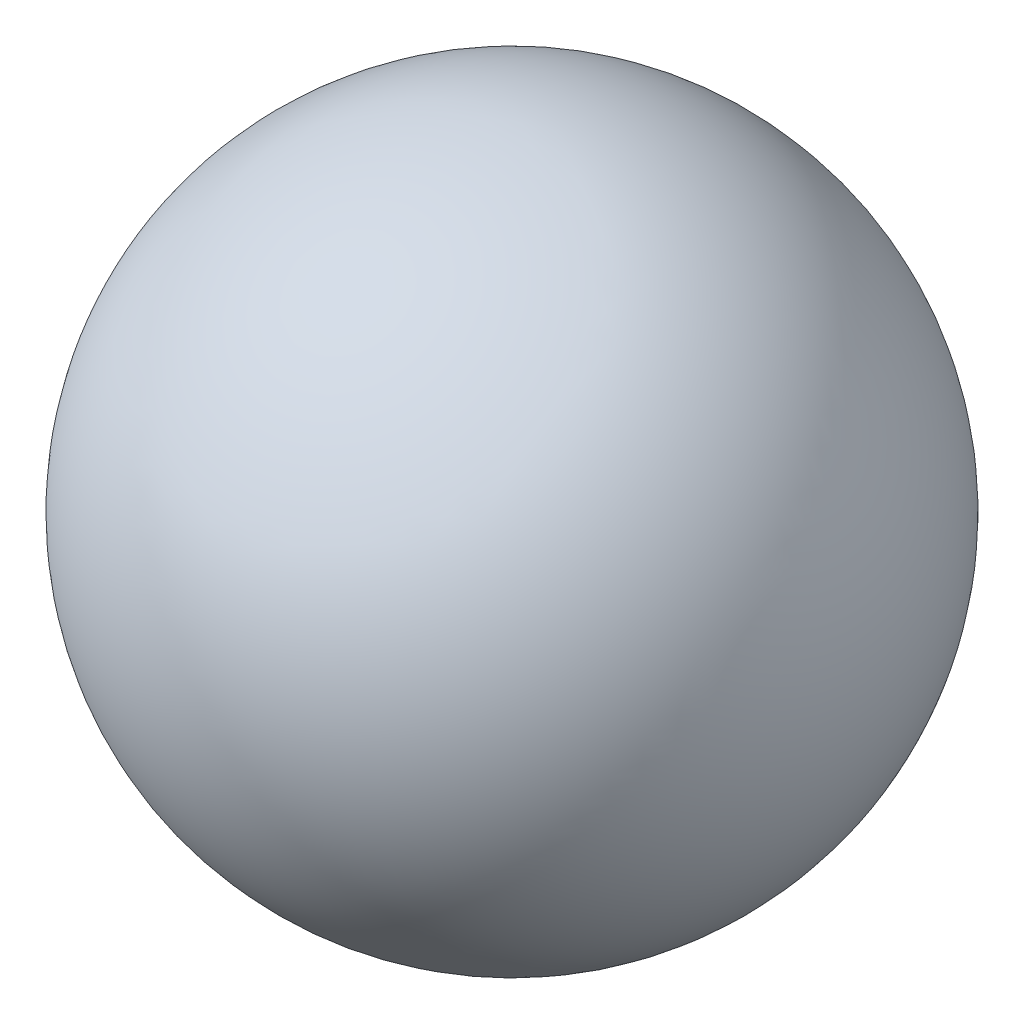
from build123d import *

# Parameters (mm, degrees)
FURO_ROSCADO_DE_M161_D           = 14
FURO_ROSCADO_DE_M161_DEPTH       = 38
FURO_ROSCADO_DE_M161_CSINK_D     = 16.05
FURO_ROSCADO_DE_M161_CSINK_ANGLE = 90
FURO_ROSCADO_DE_M161_TIP         = 4.206024333192922


with BuildPart() as part:
    # Esboço1 → Revolução1 (revolve)
    with BuildSketch(Plane(origin=(0, 0, 0), x_dir=(1, 0, 0), z_dir=(0, 1, 0))):
        with BuildLine():
            Line((46.62741699796952, 0), (0, 0))
            Line((0, 0), (0, 8))
            ThreePointArc((0, 8), (26.685864487387825, 23.65436543168373), (46.62741699796952, 0))
        make_face()
    revolve(axis=Axis((5.928556183495518, 0, 0), (1, 0, 0)))

    # Furo roscado de M161
    with Locations(Plane.ZY):
        with Locations((0, 0)):
            CounterSinkHole(FURO_ROSCADO_DE_M161_D / 2, FURO_ROSCADO_DE_M161_CSINK_D / 2, depth=FURO_ROSCADO_DE_M161_DEPTH, counter_sink_angle=FURO_ROSCADO_DE_M161_CSINK_ANGLE)
            with Locations((0, 0, -(FURO_ROSCADO_DE_M161_DEPTH + FURO_ROSCADO_DE_M161_TIP / 2))):  # 118° drill point
                Cone(0, FURO_ROSCADO_DE_M161_D / 2, FURO_ROSCADO_DE_M161_TIP, mode=Mode.SUBTRACT)


solid = part.part
